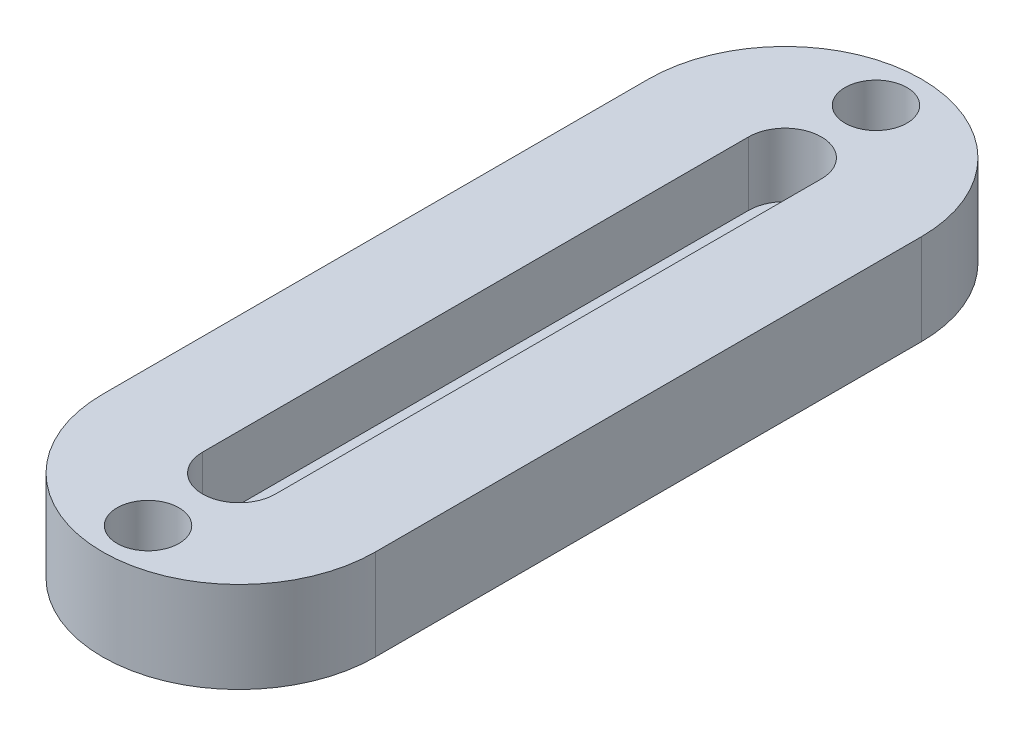
from build123d import *

# Parameters (mm, degrees)
BOSS_EXTRUDE1_DEPTH = 6.35
BOSS_EXTRUDE2_DEPTH = 1.905
SKETCH3_R           = 2.159
CUT_EXTRUDE1_DEPTH  = 12.7


with BuildPart() as part:
    # Sketch1 → Boss-Extrude1 (new body)
    with BuildSketch(Plane(origin=(0, 0, 0), x_dir=(1, 0, 0), z_dir=(0, 1, 0))):
        with BuildLine():
            Line((-6.985, 38.1), (-6.985, 0))
            ThreePointArc((-6.985, 0), (2.54, -9.525), (12.065, 0))
            Line((12.065, 0), (12.065, 38.1))
            ThreePointArc((12.065, 38.1), (2.54, 47.625), (-6.985, 38.1))
        make_face()
        with BuildLine():
            Line((0, 0), (0, 38.1))
            ThreePointArc((0, 38.1), (2.54, 40.64), (5.08, 38.1))
            Line((5.08, 38.1), (5.08, 0))
            ThreePointArc((5.08, 0), (2.54, -2.54), (0, 0))
        make_face(mode=Mode.SUBTRACT)
    extrude(amount=BOSS_EXTRUDE1_DEPTH)

    # Sketch2 → Boss-Extrude2 (add)
    with BuildSketch(Plane(origin=(0, 0, 0), x_dir=(1, 0, 0), z_dir=(0, 1, 0))):
        with BuildLine():
            Line((0, 38.1), (0, 0))
            ThreePointArc((0, 0), (2.54, -2.54), (5.08, 0))
            Line((5.08, 0), (5.08, 38.1))
            ThreePointArc((5.08, 38.1), (2.54, 40.64), (0, 38.1))
        make_face()
    extrude(amount=BOSS_EXTRUDE2_DEPTH)

    # Sketch3 → Cut-Extrude1 (cut)
    with BuildSketch(Plane(origin=(0, 6.35, 0), x_dir=(1, 0, 0), z_dir=(0, 1, 0))):
        with Locations(Location((2.54, 44.45, 0), (0, 0, 270))):
            Circle(SKETCH3_R)
        with Locations(Location((2.54, -6.35, 0), (0, 0, 270))):
            Circle(SKETCH3_R)
    extrude(amount=-CUT_EXTRUDE1_DEPTH, mode=Mode.SUBTRACT)


solid = part.part
